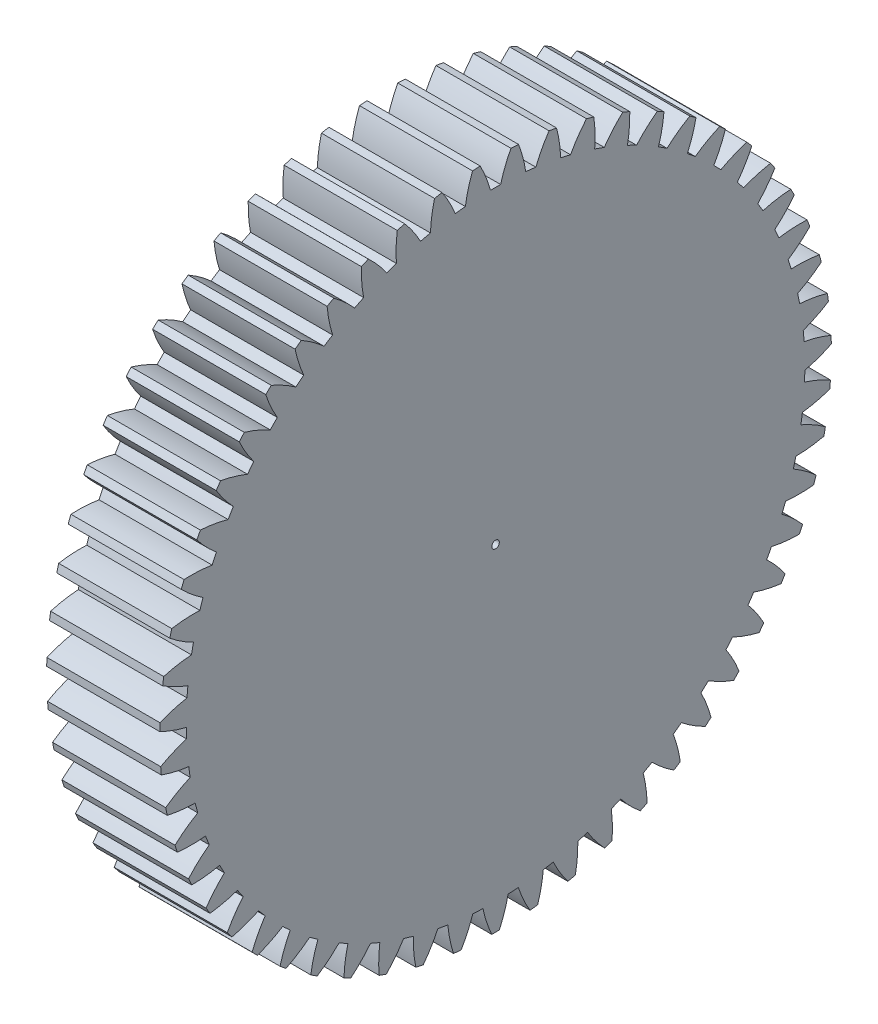
from build123d import *

# Parameters (mm, degrees)
BASPROSKE_W     = 12
BASPROSKE_H     = 35.625
TOOTHCUT_DEPTH  = 52.79074483
TEETHCUTS_COUNT = 55
TEETHCUTS_ANGLE = 353.454545455
BORSKE_R        = 0.4
BORE_DEPTH      = 50.0000508


with BuildPart() as part:
    # BasProSke → Base-Revolve (revolve)
    with BuildSketch(Plane(origin=(0, 0, 0), x_dir=(1, 0, 0), z_dir=(0, 1, 0)), mode=Mode.PRIVATE) as base_revolve_sk:
        with Locations((6, 17.8125)):
            Rectangle(BASPROSKE_W, BASPROSKE_H)
    revolve(base_revolve_sk.sketch.rotate(Axis((-10, 0, 0), (1, 0, 0)), 180), axis=Axis((-10, 0, 0), (1, 0, 0)))

    # TooCutSke → ToothCut (cut, through all)
    with BuildSketch(Plane(origin=(0, 0, 0), x_dir=(0, 0, -1), z_dir=(1, 0, 0))):
        with BuildLine():
            ThreePointArc((0.537870704, 32.807091114), (0, 32.8115), (-0.537870704, 32.807091114))
            ThreePointArc((-0.537870704, 32.807091114), (-1.013080284, 34.240186734), (-1.642549894, 35.612540628))
            ThreePointArc((-1.642549894, 35.612540628), (0, 35.6504), (1.642549894, 35.612540628))
            ThreePointArc((1.642549894, 35.612540628), (1.013080284, 34.240186734), (0.537870704, 32.807091114))
        make_face()
    toothcut = extrude(amount=TOOTHCUT_DEPTH, mode=Mode.SUBTRACT)

    # TeethCuts: ToothCut ×55 about axis
    teethcuts_axis = Axis((-10, 0, 0), (1, 0, 0))
    for i in range(1, TEETHCUTS_COUNT):
        add(toothcut.rotate(teethcuts_axis, i * TEETHCUTS_ANGLE / (TEETHCUTS_COUNT - 1)), mode=Mode.SUBTRACT)

    # BorSke → Bore (cut, symmetric)
    with BuildSketch(Plane(origin=(0, 0, 0), x_dir=(0, 0, -1), z_dir=(1, 0, 0))):
        with Locations(Location((0, 0, 0), (0, 0, 180))):
            Circle(BORSKE_R)
    extrude(amount=BORE_DEPTH, both=True, mode=Mode.SUBTRACT)


solid = part.part
